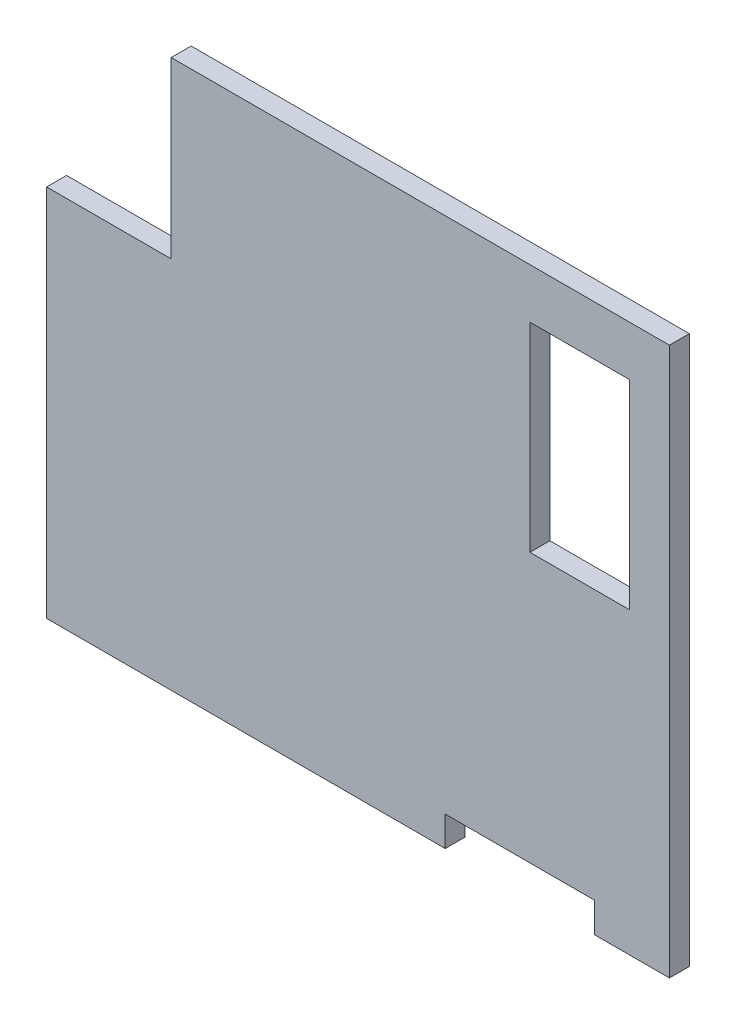
from build123d import *

# Parameters (mm, degrees)
SKIZZE1_W                       = 20
SKIZZE1_H                       = 40
AUFSATZ_LINEAR_AUSTRAGEN1_DEPTH = 4


with BuildPart() as part:
    # Skizze1 → Aufsatz-Linear austragen1 (new body)
    with BuildSketch(Plane.XY):
        Polygon((0, 0), (80, 0), (80, 6), (110, 6), (110, 0), (125, 0), (125, 110), (25, 110), (25, 75), (0, 75), align=None)
        with Locations((107, 80)):
            Rectangle(SKIZZE1_W, SKIZZE1_H, mode=Mode.SUBTRACT)
    extrude(amount=AUFSATZ_LINEAR_AUSTRAGEN1_DEPTH)


solid = part.part
